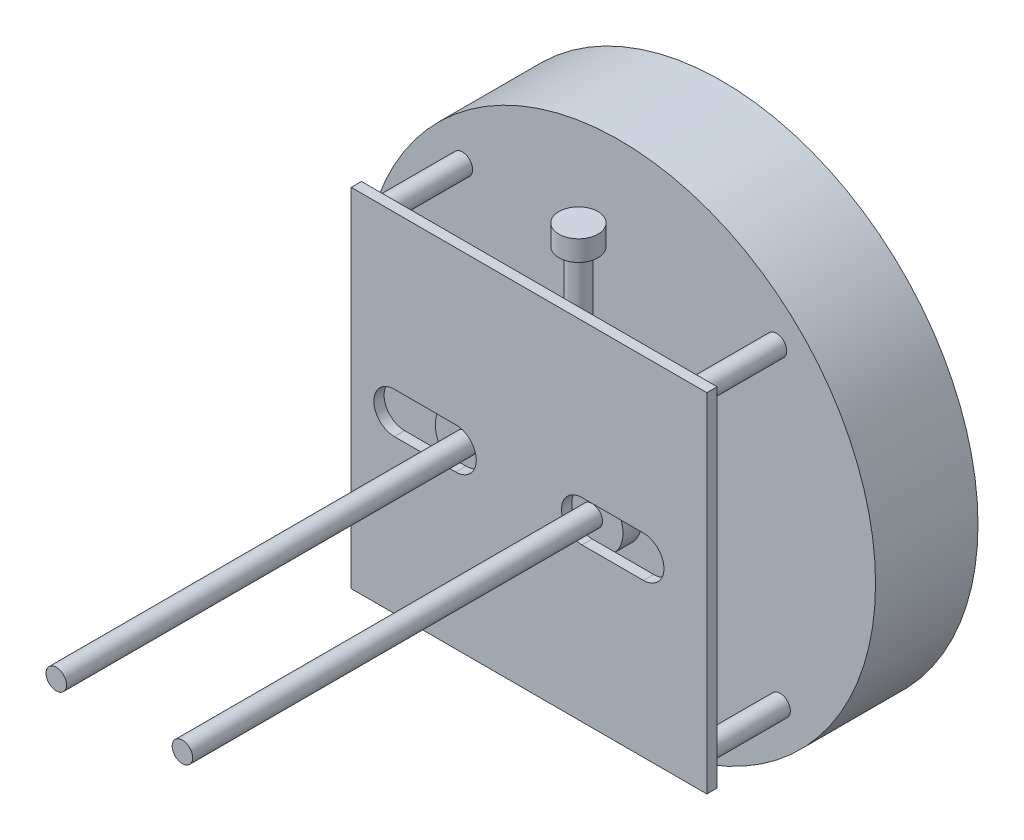
from build123d import *

# Parameters (mm, degrees)
SKETCH1_R                = 125
BOSS_EXTRUDE1_DEPTH      = 50
SKETCH2_R                = 5
BOSS_EXTRUDE2_DEPTH      = 40
SKETCH3_W                = 173.547668106
SKETCH3_H                = 169.627700242
BOSS_EXTRUDE3_DEPTH      = 5
CUT_EXTRUDE1_DEPTH       = 19
SKETCH5_R                = 15
BOSS_EXTRUDE4_DEPTH      = 9
SKETCH6_R                = 5
BOSS_EXTRUDE5_DEPTH      = 200
SKETCH7_R                = 5
BOSS_EXTRUDE6_DEPTH      = 20
SWEEP1_PROFILE_R         = 5
SWEEP2_PROFILE_R         = 5
SWEEP3_PROFILE_R         = 5
BOSS_EXTRUDE7_DEPTH      = 0.006
BOSS_EXTRUDE7_DEPTH_BACK = 10
SKETCH46_R               = 9.545389902
BOSS_EXTRUDE8_DEPTH      = 0.006
BOSS_EXTRUDE8_DEPTH_BACK = 10
SKETCH47_R               = 9.487209185


with BuildPart() as part:
    # Sketch1 → Boss-Extrude1 (new body)
    with BuildSketch(Plane.XY):
        Circle(SKETCH1_R)
    extrude(amount=BOSS_EXTRUDE1_DEPTH)

    # Sketch2 → Boss-Extrude2 (add)
    with BuildSketch(Plane.XY.offset(50)):
        with Locations((-76.642135624, 76.642135624)):
            Circle(SKETCH2_R)
        with Locations((76.642135624, 76.642135624)):
            Circle(SKETCH2_R)
        with Locations((78.413691156, -74.61422444)):
            Circle(SKETCH2_R)
        with Locations((-76.642135624, -76.642135624)):
            Circle(SKETCH2_R)
    extrude(amount=BOSS_EXTRUDE2_DEPTH)

    # Sketch3 → Boss-Extrude3 (add)
    with BuildSketch(Plane.XY.offset(90)):
        with Locations((0.890901787, -0.253218284)):
            Rectangle(SKETCH3_W, SKETCH3_H)
    extrude(amount=BOSS_EXTRUDE3_DEPTH)

    # Sketch4 → Cut-Extrude1 (cut)
    with BuildSketch(Plane.XY.offset(95)):
        with BuildLine():
            Line((-64.857650093, 9.746781716), (-34.857650093, 9.746781716))
            ThreePointArc((-34.857650093, 9.746781716), (-24.857650093, -0.253218284), (-34.857650093, -10.253218284))
            Line((-34.857650093, -10.253218284), (-64.857650093, -10.253218284))
            ThreePointArc((-64.857650093, -10.253218284), (-74.857650093, -0.253218284), (-64.857650093, 9.746781716))
        make_face()
        with BuildLine():
            Line((26.72705361, 9.746781716), (56.72705361, 9.746781716))
            ThreePointArc((56.72705361, 9.746781716), (66.72705361, -0.253218284), (56.72705361, -10.253218284))
            Line((56.72705361, -10.253218284), (26.72705361, -10.253218284))
            ThreePointArc((26.72705361, -10.253218284), (16.72705361, -0.253218284), (26.72705361, 9.746781716))
        make_face()
    extrude(amount=-CUT_EXTRUDE1_DEPTH, mode=Mode.SUBTRACT)

    # Sketch5 → Boss-Extrude4 (add)
    with BuildSketch(Plane(origin=(0, 0, 90), x_dir=(-1, 0, 0), z_dir=(0, 0, -1))):
        with Locations((-26.72705361, -0.253218284)):
            Circle(SKETCH5_R)
        with Locations((34.857650093, -0.253218284)):
            Circle(SKETCH5_R)
    extrude(amount=BOSS_EXTRUDE4_DEPTH)

    # Sketch6 → Boss-Extrude5 (add)
    with BuildSketch(Plane.XY.offset(90)):
        with Locations((26.72705361, -0.253218284)):
            Circle(SKETCH6_R)
        with Locations((-34.857650093, -0.253218284)):
            Circle(SKETCH6_R)
    extrude(amount=BOSS_EXTRUDE5_DEPTH)

    # Sketch7 → Boss-Extrude6 (add)
    with BuildSketch(Plane.XY.offset(50)):
        with Locations((0, 30)):
            Circle(SKETCH7_R)
        with Locations((0, -30)):
            Circle(SKETCH7_R)
    extrude(amount=BOSS_EXTRUDE6_DEPTH)

    # Sweep1: sweep along a path in Sketch8
    with BuildLine(Plane.XY.offset(70)) as sweep1_path:
        Line((0, 30), (0, 100))
    # Sweep1 profile (on start of the path) → Sweep1 (sweep)
    with BuildSketch(Plane(origin=(0, 30, 70), x_dir=(0, 0, 1), z_dir=(0, 1, 0))):
        Circle(SWEEP1_PROFILE_R)
    sweep(path=sweep1_path.line)

    # Sweep2: sweep along a path in Sketch8<3>
    with BuildLine(Plane.XY.offset(70)) as sweep2_path:
        Line((0, -30), (0, -100))
    # Sweep2 profile (on start of the path) → Sweep2 (sweep)
    with BuildSketch(Plane(origin=(0, -30, 70), x_dir=(-1, 0, 0), z_dir=(0, -1, 0))):
        Circle(SWEEP2_PROFILE_R)
    sweep(path=sweep2_path.line)

    # Sweep3: sweep along a path in Sketch8<4>
    with BuildLine(Plane.XY.offset(70)) as sweep3_path:
        Line((0, 100), (0, 30))
        Line((0, 30), (0, 25))
    # Sweep3 profile (on start of the path) → Sweep3 (sweep)
    with BuildSketch(Plane(origin=(0, 100, 70), x_dir=(0, 0, -1), z_dir=(0, -1, 0))):
        Circle(SWEEP3_PROFILE_R)
    sweep(path=sweep3_path.line)

    # Sketch46 → Boss-Extrude7 (add, two sides: drawn at the far end of the back side and taken through both)
    with BuildSketch(Plane(origin=(0, 100, 0), x_dir=(1, 0, 0), z_dir=(0, 1, 0)).offset(-BOSS_EXTRUDE7_DEPTH_BACK)):
        with Locations((0, -70)):
            Circle(SKETCH46_R)
    extrude(amount=BOSS_EXTRUDE7_DEPTH + BOSS_EXTRUDE7_DEPTH_BACK)

    # Sketch47 → Boss-Extrude8 (add, two sides: drawn at the far end of the back side and taken through both)
    with BuildSketch(Plane.XZ.offset(100).offset(-BOSS_EXTRUDE8_DEPTH_BACK)):
        with Locations((0, 70)):
            Circle(SKETCH47_R)
    extrude(amount=BOSS_EXTRUDE8_DEPTH + BOSS_EXTRUDE8_DEPTH_BACK)


solid = part.part
